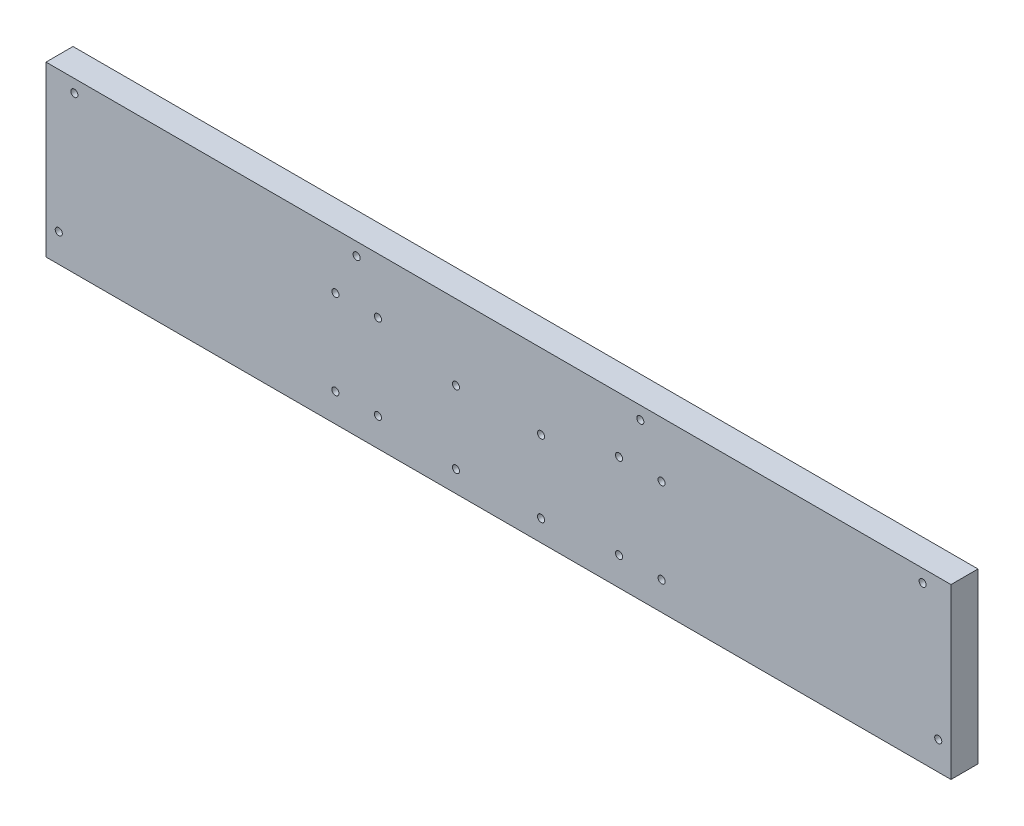
from build123d import *

# Parameters (mm, degrees)
SKETCH1_W                 = 638.1
SKETCH1_H                 = 119.05
BOSS_EXTRUDE1_DEPTH       = 19.05
F_5_0MM_DOWEL_HOLE1_D     = 5
F_5_0MM_DOWEL_HOLE1_DEPTH = 28.497848452
F_5_0MM_DOWEL_HOLE1_TIP   = 1.502151548


with BuildPart() as part:
    # Sketch1 → Boss-Extrude1 (new body)
    with BuildSketch(Plane.XY):
        with Locations((-319.05, 59.525)):
            Rectangle(SKETCH1_W, SKETCH1_H)
    extrude(amount=BOSS_EXTRUDE1_DEPTH)

    # Ø5.0mm Dowel Hole1
    with Locations(Plane(origin=(0, 0, 0), x_dir=(-1, 0, 0), z_dir=(0, 0, -1))):
        with Locations((434.05, 20), (404.05, 20), (404.05, 80), (434.05, 80), (349.05, 15), (349.05, 66), (289.05, 66), (289.05, 15), (234.05, 20), (234.05, 80), (204.05, 80), (204.05, 20), (629.1, 20), (618.1, 110.05), (419.05, 110.05), (219.05, 110.05), (20, 110.05), (9, 20)):
            Hole(F_5_0MM_DOWEL_HOLE1_D / 2, depth=F_5_0MM_DOWEL_HOLE1_DEPTH)
            with Locations((0, 0, -(F_5_0MM_DOWEL_HOLE1_DEPTH + F_5_0MM_DOWEL_HOLE1_TIP / 2))):  # 118° drill point
                Cone(0, F_5_0MM_DOWEL_HOLE1_D / 2, F_5_0MM_DOWEL_HOLE1_TIP, mode=Mode.SUBTRACT)


solid = part.part
